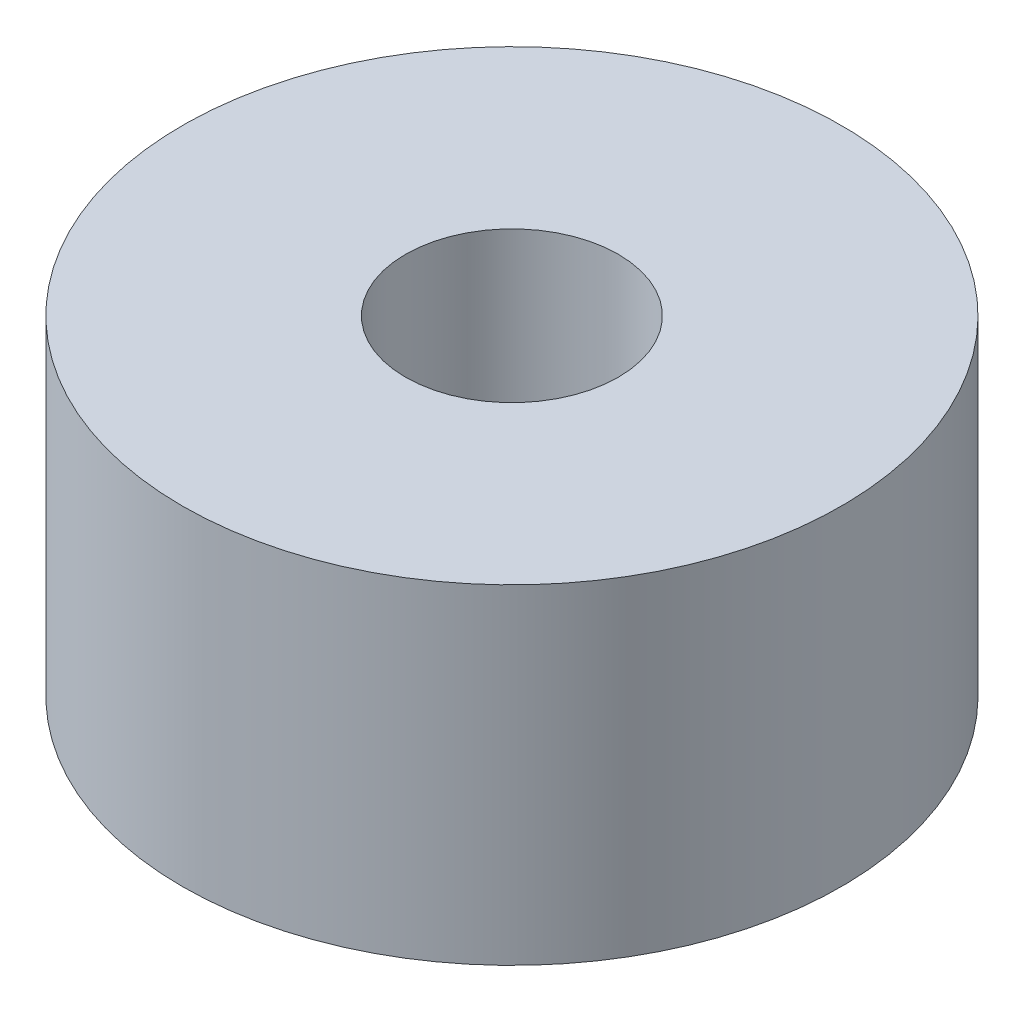
from build123d import *

# Parameters (mm, degrees)
SKETCH1_R           = 12.7
SKETCH1_R_2         = 4.1021
BOSS_EXTRUDE1_DEPTH = 12.7


with BuildPart() as part:
    # Sketch1 → Boss-Extrude1 (new body)
    with BuildSketch(Plane(origin=(0, 0, 0), x_dir=(1, 0, 0), z_dir=(0, 1, 0))):
        with Locations(Location((0, 0, 0), (0, 0, 270))):
            Circle(SKETCH1_R)
        with Locations(Location((0, 0, 0), (0, 0, 270))):
            Circle(SKETCH1_R_2, mode=Mode.SUBTRACT)
    extrude(amount=BOSS_EXTRUDE1_DEPTH)


solid = part.part
